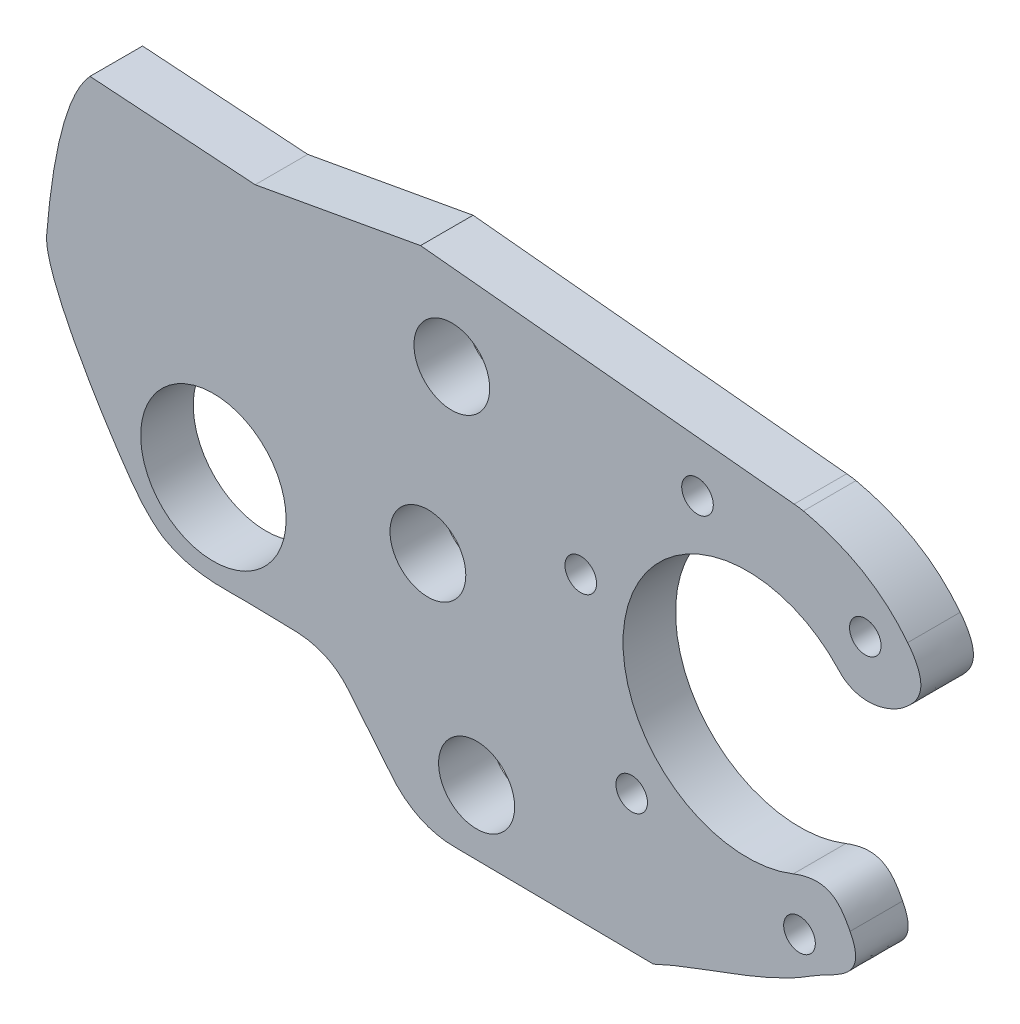
from build123d import *

# Parameters (mm, degrees)
SKETCH1_R           = 13.83528528
SKETCH1_R_2         = 7.235591107
SKETCH1_R_3         = 3.011320737
SKETCH1_R_4         = 7.213103978
SKETCH1_R_5         = 3.002883417
SKETCH1_R_6         = 3.009410698
SKETCH1_R_7         = 7.205059389
SKETCH1_R_8         = 3.006464833
SKETCH1_R_9         = 3.002887994
BOSS_EXTRUDE3_DEPTH = 10
SCALE6_SCALE        = 0.75


with BuildPart() as part:
    # Sketch1 → Boss-Extrude3 (new body)
    with BuildSketch(Plane.XY):
        with BuildLine():
            add(Edge.make_bspline(
                [(390.702437401, 591.546424948), (390.170237401, 591.665524948), (389.498937401, 591.746824948), (388.937137401, 591.801924948)],
                knots=[0.166666667, 0.166666667, 0.166666667, 0.166666667, 0.208333333, 0.208333333, 0.208333333, 0.208333333], degree=3))
            Line((388.937137401, 591.801924948), (317.8384, 598.8518))
            Line((317.8384, 598.8518), (286.3759, 593.1514))
            Line((286.3759, 593.1514), (254.9413, 595.2929))
            add(Edge.make_bspline(
                [(254.9413, 595.2929), (249.749, 589.6403), (247.5763, 576.1381), (246.6964, 565.0014)],
                knots=[0.333333333, 0.333333333, 0.333333333, 0.333333333, 0.375, 0.375, 0.375, 0.375], degree=3))
            add(Edge.make_bspline(
                [(246.6964, 565.0014), (246.2536, 559.3969), (253.8266, 545.9237), (260.2361, 536.2788)],
                knots=[0.375, 0.375, 0.375, 0.375, 0.416666667, 0.416666667, 0.416666667, 0.416666667], degree=3))
            add(Edge.make_bspline(
                [(260.2361, 536.2788), (261.9315, 533.7276), (265.3965, 528.2241), (269.3831, 526.0001)],
                knots=[0.416666667, 0.416666667, 0.416666667, 0.416666667, 0.458333333, 0.458333333, 0.458333333, 0.458333333], degree=3))
            add(Edge.make_bspline(
                [(269.3831, 526.0001), (274.7125, 523.027), (280.9349, 523.6791), (284.7215, 523.5997)],
                knots=[0.458333333, 0.458333333, 0.458333333, 0.458333333, 0.5, 0.5, 0.5, 0.5], degree=3))
            Line((284.7215, 523.5997), (294.3118, 523.3986))
            add(Edge.make_bspline(
                [(294.3118, 523.3986), (298.656, 523.1896), (301.8697, 521.53), (304.1649, 518.6915)],
                knots=[0.541666667, 0.541666667, 0.541666667, 0.541666667, 0.583333333, 0.583333333, 0.583333333, 0.583333333], degree=3))
            Line((304.1649, 518.6915), (313.1736, 507.7735))
            add(Edge.make_bspline(
                [(313.1736, 507.7735), (316.1604, 504.7059), (319.8516, 502.9821), (324.4499, 502.9891)],
                knots=[0.625, 0.625, 0.625, 0.625, 0.666666667, 0.666666667, 0.666666667, 0.666666667], degree=3))
            Line((324.4499, 502.9891), (362.1482, 502.591))
            add(Edge.make_bspline(
                [(362.1482, 502.591), (370.3987, 506.5747), (383.2456, 509.8601), (391.8953, 515.4769)],
                knots=[0.708333333, 0.708333333, 0.708333333, 0.708333333, 0.75, 0.75, 0.75, 0.75], degree=3))
            add(Edge.make_bspline(
                [(391.8953, 515.4769), (396.6269, 518.5494), (403.2187, 519.6191), (399.5807, 526.7157)],
                knots=[0.75, 0.75, 0.75, 0.75, 0.791666667, 0.791666667, 0.791666667, 0.791666667], degree=3))
            add(Edge.make_bspline(
                [(399.5807, 526.7157), (397.6964, 530.3909), (395.5139, 533.4064), (388.7679, 530.7766)],
                knots=[0.791666667, 0.791666667, 0.791666667, 0.791666667, 0.833333333, 0.833333333, 0.833333333, 0.833333333], degree=3))
            ThreePointArc((388.7679, 530.7766), (356.972685935, 558.005631546), (397.461737401, 568.635424948))
            add(Edge.make_bspline(
                [(397.461737401, 568.635424948), (400.930937401, 564.911724948), (406.485637401, 566.174424948), (409.760237401, 568.677624948)],
                knots=[0.041666667, 0.041666667, 0.041666667, 0.041666667, 0.083333333, 0.083333333, 0.083333333, 0.083333333], degree=3))
            add(Edge.make_bspline(
                [(409.760237401, 568.677624948), (413.064537401, 571.203624948), (414.760537401, 574.392624948), (410.538737401, 579.771624948)],
                knots=[0.083333333, 0.083333333, 0.083333333, 0.083333333, 0.125, 0.125, 0.125, 0.125], degree=3))
            add(Edge.make_bspline(
                [(410.538737401, 579.771624948), (405.594037401, 586.071924948), (398.916537401, 589.707824948), (390.702437401, 591.546424948)],
                knots=[0.125, 0.125, 0.125, 0.125, 0.166666667, 0.166666667, 0.166666667, 0.166666667], degree=3))
        make_face()
        with Locations((278.423738523, 540.940981928)):
            Circle(SKETCH1_R, mode=Mode.SUBTRACT)
        with Locations((328.512486768, 515.283376314)):
            Circle(SKETCH1_R_2, mode=Mode.SUBTRACT)
        with Locations((389.953559171, 521.398342198)):
            Circle(SKETCH1_R_3, mode=Mode.SUBTRACT)
        with Locations((319.240426613, 548.839403542)):
            Circle(SKETCH1_R_4, mode=Mode.SUBTRACT)
        with Locations((358.027351347, 528.638383691)):
            Circle(SKETCH1_R_5, mode=Mode.SUBTRACT)
        with Locations((348.329436617, 559.905288749)):
            Circle(SKETCH1_R_6, mode=Mode.SUBTRACT)
        with Locations((323.793948601, 581.881607046)):
            Circle(SKETCH1_R_7, mode=Mode.SUBTRACT)
        with Locations((370.54631834, 583.947774508)):
            Circle(SKETCH1_R_8, mode=Mode.SUBTRACT)
        with Locations((402.475445199, 576.716414423)):
            Circle(SKETCH1_R_9, mode=Mode.SUBTRACT)
    extrude(amount=BOSS_EXTRUDE3_DEPTH)


with BuildPart() as part_1:
    # Scale6: scaled about (0, 0, 0)
    add(part.part.scale(SCALE6_SCALE))


solid = part_1.part
